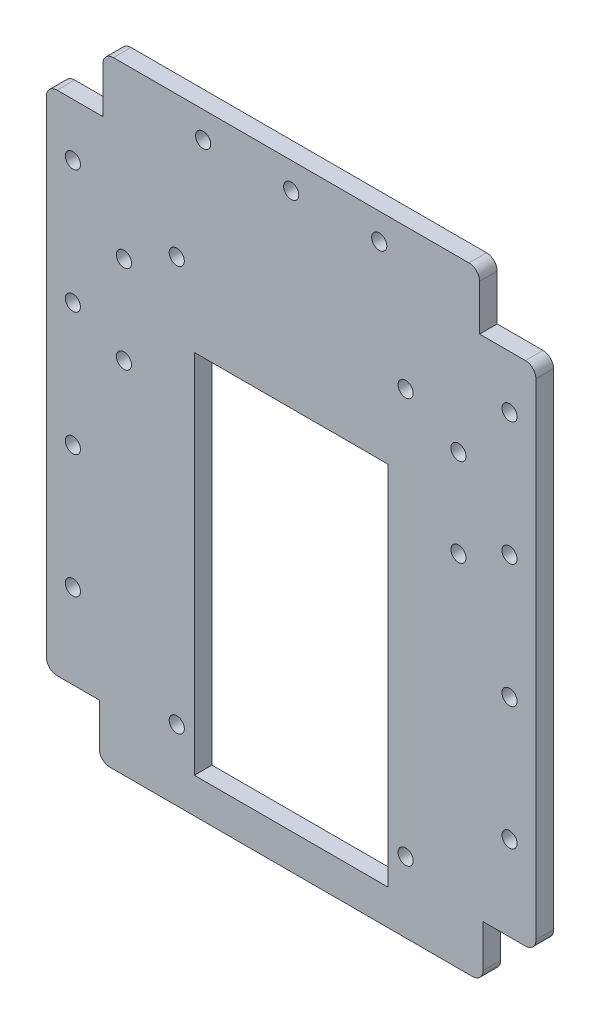
from build123d import *

# Parameters (mm, degrees)
SKETCH1_W           = 139
SKETCH1_H           = 160
BOSS_EXTRUDE1_DEPTH = 5
SKETCH2_W           = 16
SKETCH2_H           = 16
CUT_EXTRUDE1_DEPTH  = 5
SKETCH3_R           = 2.15
CUT_EXTRUDE2_DEPTH  = 5
SKETCH4_R           = 2.15
CUT_EXTRUDE3_DEPTH  = 5
LPATTERN1_COUNT     = 4
LPATTERN1_PITCH     = 35
SKETCH5_R           = 2.15
CUT_EXTRUDE4_DEPTH  = 5
SKETCH6_W           = 109
SKETCH6_H           = 15
BOSS_EXTRUDE2_DEPTH = 5
SKETCH7_W           = 55
SKETCH7_H           = 104
CUT_EXTRUDE5_DEPTH  = 5
SKETCH8_R           = 2.15
CUT_EXTRUDE6_DEPTH  = 5
FILLET1_R           = 3


with BuildPart() as part:
    # Sketch1 → Boss-Extrude1 (new body)
    with BuildSketch(Plane.XY):
        with Locations((69.5, 80)):
            Rectangle(SKETCH1_W, SKETCH1_H)
    extrude(amount=BOSS_EXTRUDE1_DEPTH)

    # Sketch2 → Cut-Extrude1 (cut)
    with BuildSketch(Plane.XY.offset(5)):
        with Locations((131, 152)):
            Rectangle(SKETCH2_W, SKETCH2_H)
        with Locations((8, 152)):
            Rectangle(SKETCH2_W, SKETCH2_H)
    extrude(amount=-CUT_EXTRUDE1_DEPTH, mode=Mode.SUBTRACT)

    # Sketch3 → Cut-Extrude2 (cut)
    with BuildSketch(Plane.XY.offset(5)):
        with Locations((69.5, 152.5)):
            Circle(SKETCH3_R)
        with Locations((44.5, 152.5)):
            Circle(SKETCH3_R)
        with Locations(Location((94.5, 152.5, 0), (0, 0, 180))):
            Circle(SKETCH3_R)
    extrude(amount=-CUT_EXTRUDE2_DEPTH, mode=Mode.SUBTRACT)

    # Sketch4 → Cut-Extrude3 (cut)
    with BuildSketch(Plane.XY.offset(5)):
        with Locations((131.5, 129)):
            Circle(SKETCH4_R)
        with Locations(Location((7.5, 129, 0), (0, 0, 180))):
            Circle(SKETCH4_R)
    cut_extrude3 = extrude(amount=-CUT_EXTRUDE3_DEPTH, mode=Mode.SUBTRACT)

    # LPattern1: Cut-Extrude3 ×4
    with Locations(*[(0, -i * LPATTERN1_PITCH, 0) for i in range(1, LPATTERN1_COUNT)]):
        add(cut_extrude3, mode=Mode.SUBTRACT)

    # Sketch5 → Cut-Extrude4 (cut)
    with BuildSketch(Plane.XY.offset(5)):
        with Locations((117, 112)):
            Circle(SKETCH5_R)
        with Locations((117, 87)):
            Circle(SKETCH5_R)
        with Locations(Location((22, 87, 0), (0, 0, 180))):
            Circle(SKETCH5_R)
        with Locations(Location((22, 112, 0), (0, 0, 180))):
            Circle(SKETCH5_R)
    extrude(amount=-CUT_EXTRUDE4_DEPTH, mode=Mode.SUBTRACT)

    # Sketch6 → Boss-Extrude2 (add)
    with BuildSketch(Plane(origin=(0, 0, 0), x_dir=(-1, 0, 0), z_dir=(0, 0, -1))):
        with Locations((-69.5, -7.5)):
            Rectangle(SKETCH6_W, SKETCH6_H)
    extrude(amount=-BOSS_EXTRUDE2_DEPTH)

    # Sketch7 → Cut-Extrude5 (cut)
    with BuildSketch(Plane.XY.offset(5)):
        with Locations((69.5, 47)):
            Rectangle(SKETCH7_W, SKETCH7_H)
    extrude(amount=-CUT_EXTRUDE5_DEPTH, mode=Mode.SUBTRACT)

    # Sketch8 → Cut-Extrude6 (cut)
    with BuildSketch(Plane.XY.offset(5)):
        with Locations((102, 5)):
            Circle(SKETCH8_R)
        with Locations((102, 120)):
            Circle(SKETCH8_R)
        with Locations(Location((37, 120, 0), (0, 0, 180))):
            Circle(SKETCH8_R)
        with Locations(Location((37, 5, 0), (0, 0, 180))):
            Circle(SKETCH8_R)
    extrude(amount=-CUT_EXTRUDE6_DEPTH, mode=Mode.SUBTRACT)

    # Fillet1
    fillet1_edges = [part.edges().sort_by_distance(p)[0] for p in [
        (124, -15, 2.5),
        (15, -15, 2.5),
        (139, 144, 2.5),
        (123, 160, 2.5),
        (16, 160, 2.5),
        (0, 144, 2.5),
        (139, 0, 2.5),
        (0, 0, 2.5),
    ]]
    fillet(fillet1_edges, radius=FILLET1_R)


solid = part.part
